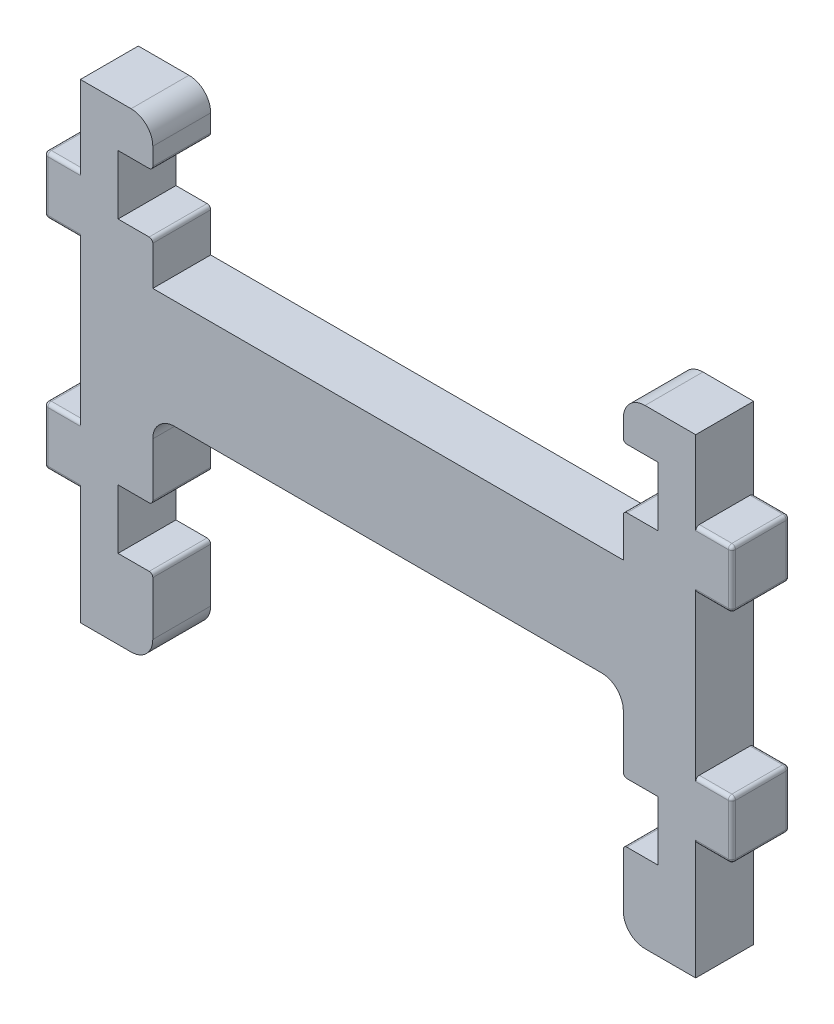
from build123d import *

# Parameters (mm, degrees)
CROQUIS1_W               = 85
CROQUIS1_H               = 65
SALIENTE_EXTRUIR1_DEPTH  = 8
CROQUIS2_W               = 65
CROQUIS2_H               = 20
CORTAR_EXTRUIR1_DEPTH    = 8
CROQUIS3_W               = 65
CROQUIS3_H               = 30
CORTAR_EXTRUIR2_DEPTH    = 8
REDONDEO1_R              = 3
CROQUIS4_W               = 8
CROQUIS4_H               = 8
SALIENTE_EXTRUIR2_DEPTH  = 5
REDONDEO2_R              = 0.5
REDONDEO2_OF_SIMETR_A1_R = 0.5
REDONDEO3_R              = 3
CROQUIS5_W               = 4.8
CROQUIS5_H               = 8.2
CORTAR_EXTRUIR3_DEPTH    = 59.107658703
REDONDEO4_R              = 0.5


with BuildPart() as part:
    # Croquis1 → Saliente-Extruir1 (new body)
    with BuildSketch(Plane.XY):
        Rectangle(CROQUIS1_W, CROQUIS1_H)
    extrude(amount=SALIENTE_EXTRUIR1_DEPTH)

    # Croquis2 → Cortar-Extruir1 (cut)
    with BuildSketch(Plane.XY.offset(8)):
        with Locations((0, 22.5)):
            Rectangle(CROQUIS2_W, CROQUIS2_H)
    extrude(amount=-CORTAR_EXTRUIR1_DEPTH, mode=Mode.SUBTRACT)

    # Croquis3 → Cortar-Extruir2 (cut)
    with BuildSketch(Plane.XY.offset(8)):
        with Locations((0, -17.5)):
            Rectangle(CROQUIS3_W, CROQUIS3_H)
    extrude(amount=-CORTAR_EXTRUIR2_DEPTH, mode=Mode.SUBTRACT)

    # Redondeo1
    redondeo1_edges = [part.edges().sort_by_distance(p)[0] for p in [
        (-32.5, -2.5, 4),
        (32.5, -2.5, 4),
    ]]
    fillet(redondeo1_edges, radius=REDONDEO1_R)

    # Croquis4 → Saliente-Extruir2 (add)
    with BuildSketch(Plane.ZY.offset(42.5)):
        with Locations((4, -12.5)):
            Rectangle(CROQUIS4_W, CROQUIS4_H)
        with Locations((4, 17.5)):
            Rectangle(CROQUIS4_W, CROQUIS4_H)
    saliente_extruir2 = extrude(amount=SALIENTE_EXTRUIR2_DEPTH)

    # Redondeo2
    redondeo2_edges = [part.edges().sort_by_distance(p)[0] for p in [
        (-45, -8.5, 0),
        (-45, -16.5, 0),
        (-45, -16.5, 8),
        (-45, -8.5, 8),
        (-47.5, -12.5, 0),
        (-47.5, -16.5, 4),
        (-47.5, -12.5, 8),
        (-47.5, -8.5, 4),
        (-45, 21.5, 0),
        (-45, 13.5, 0),
        (-45, 13.5, 8),
        (-45, 21.5, 8),
        (-47.5, 17.5, 0),
        (-47.5, 13.5, 4),
        (-47.5, 17.5, 8),
        (-47.5, 21.5, 4),
    ]]
    fillet(redondeo2_edges, radius=REDONDEO2_R)

    # Simetría1: Saliente-Extruir2 across plane
    add(saliente_extruir2.mirror(Plane(origin=(0, 0, 0), x_dir=(0, 0, 1), z_dir=(1, 0, 0))))

    # Redondeo2 of Simetría1
    redondeo2_of_simetr_a1_edges = [part.edges().sort_by_distance(p)[0] for p in [
        (45, -8.5, 0),
        (45, -16.5, 0),
        (45, -16.5, 8),
        (45, -8.5, 8),
        (47.5, -12.5, 0),
        (47.5, -16.5, 4),
        (47.5, -12.5, 8),
        (47.5, -8.5, 4),
        (45, 21.5, 0),
        (45, 13.5, 0),
        (45, 13.5, 8),
        (45, 21.5, 8),
        (47.5, 17.5, 0),
        (47.5, 13.5, 4),
        (47.5, 17.5, 8),
        (47.5, 21.5, 4),
    ]]
    fillet(redondeo2_of_simetr_a1_edges, radius=REDONDEO2_OF_SIMETR_A1_R)

    # Redondeo3
    redondeo3_edges = [part.edges().sort_by_distance(p)[0] for p in [
        (-32.5, 32.5, 4),
        (32.5, 32.5, 4),
        (-32.5, -32.5, 4),
        (32.5, -32.5, 4),
    ]]
    fillet(redondeo3_edges, radius=REDONDEO3_R)

    # Croquis5 → Cortar-Extruir3 (cut, through all)
    with BuildSketch(Plane.XY.offset(8)):
        with Locations((-34.9, 22.5)):
            Rectangle(CROQUIS5_W, CROQUIS5_H)
        with Locations((-34.9, -17.5)):
            Rectangle(CROQUIS5_W, CROQUIS5_H)
        with Locations((34.9, -17.5)):
            Rectangle(CROQUIS5_W, CROQUIS5_H)
        with Locations((34.9, 22.5)):
            Rectangle(CROQUIS5_W, CROQUIS5_H)
    extrude(amount=-CORTAR_EXTRUIR3_DEPTH, mode=Mode.SUBTRACT)

    # Redondeo4
    redondeo4_edges = [part.edges().sort_by_distance(p)[0] for p in [
        (32.5, 26.6, 4),
        (32.5, 18.4, 4),
        (32.5, -13.4, 4),
        (32.5, -21.6, 4),
        (-32.5, -13.4, 4),
        (-32.5, -21.6, 4),
        (-32.5, 26.6, 4),
        (-32.5, 18.4, 4),
    ]]
    fillet(redondeo4_edges, radius=REDONDEO4_R)


solid = part.part
